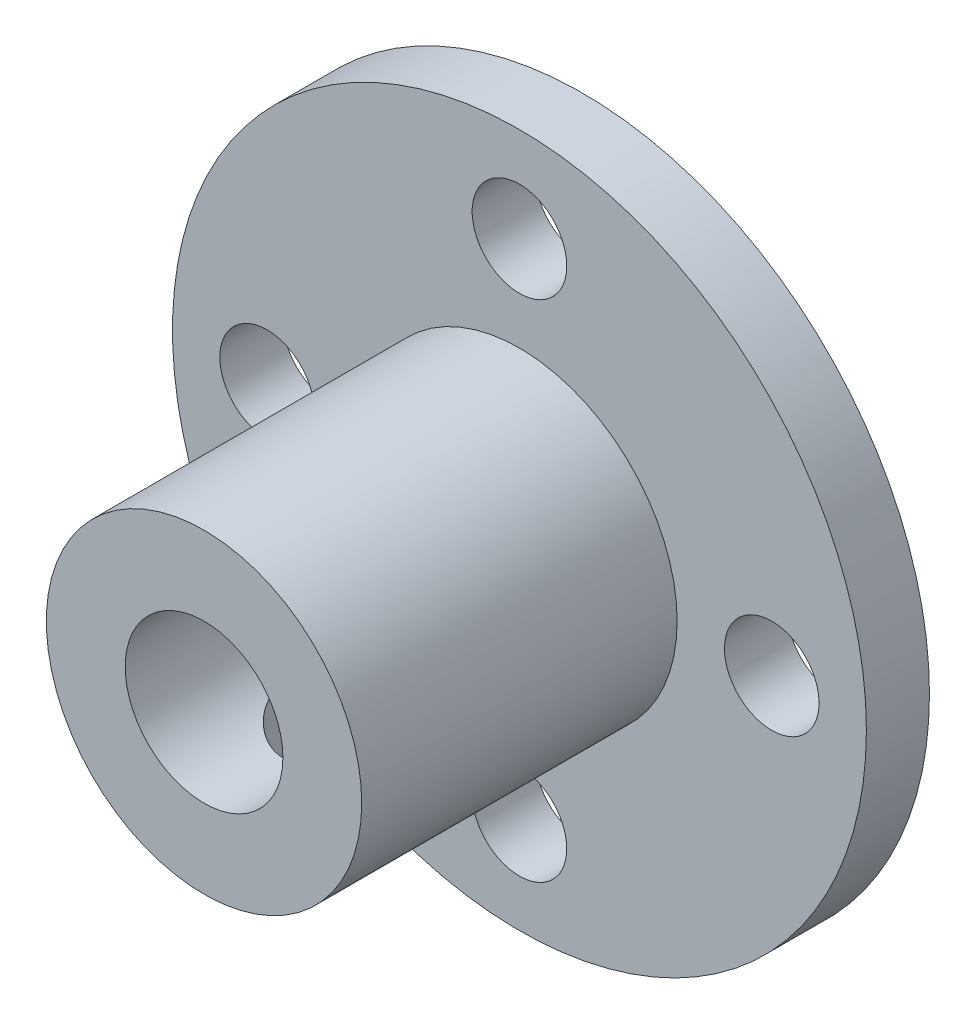
from build123d import *

# Parameters (mm, degrees)
SKETCH2_R           = 10.999999971
BOSS_EXTRUDE1_DEPTH = 2
SKETCH3_R           = 5
BOSS_EXTRUDE2_DEPTH = 10
SKETCH4_R           = 2.5
CUT_EXTRUDE1_DEPTH  = 20.646882672
SKETCH5_R           = 1.500000048
CUT_EXTRUDE2_DEPTH  = 10
SKETCH6_R           = 1.5
CUT_EXTRUDE3_DEPTH  = 19.493242028
CIRPATTERN1_COUNT   = 4


with BuildPart() as part:
    # Sketch2 → Boss-Extrude1 (new body)
    with BuildSketch(Plane.XY):
        Circle(SKETCH2_R)
    extrude(amount=BOSS_EXTRUDE1_DEPTH)

    # Sketch3 → Boss-Extrude2 (add)
    with BuildSketch(Plane.XY.offset(2)):
        Circle(SKETCH3_R)
    extrude(amount=BOSS_EXTRUDE2_DEPTH)

    # Sketch4 → Cut-Extrude1 (cut, through all)
    with BuildSketch(Plane.XY.offset(12)):
        Circle(SKETCH4_R)
    extrude(amount=-CUT_EXTRUDE1_DEPTH, mode=Mode.SUBTRACT)

    # Sketch5 → Cut-Extrude2 (cut)
    with BuildSketch(Plane(origin=(0, 0, 0), x_dir=(1, 0, 0), z_dir=(0, 1, 0))):
        with Locations(Location((0, -8, 0), (0, 0, 270))):
            Circle(SKETCH5_R)
    extrude(amount=-CUT_EXTRUDE2_DEPTH, mode=Mode.SUBTRACT)

    # Sketch6 → Cut-Extrude3 (cut, through all)
    with BuildSketch(Plane.XY.offset(2)):
        with Locations((0, 8)):
            Circle(SKETCH6_R)
    cut_extrude3 = extrude(amount=-CUT_EXTRUDE3_DEPTH, mode=Mode.SUBTRACT)

    # CirPattern1: Cut-Extrude3 ×4 about axis
    cirpattern1_axis = Axis((0, 0, 0), (0, 0, 1))
    for i in range(1, CIRPATTERN1_COUNT):
        add(cut_extrude3.rotate(cirpattern1_axis, i * 360 / CIRPATTERN1_COUNT), mode=Mode.SUBTRACT)


solid = part.part
